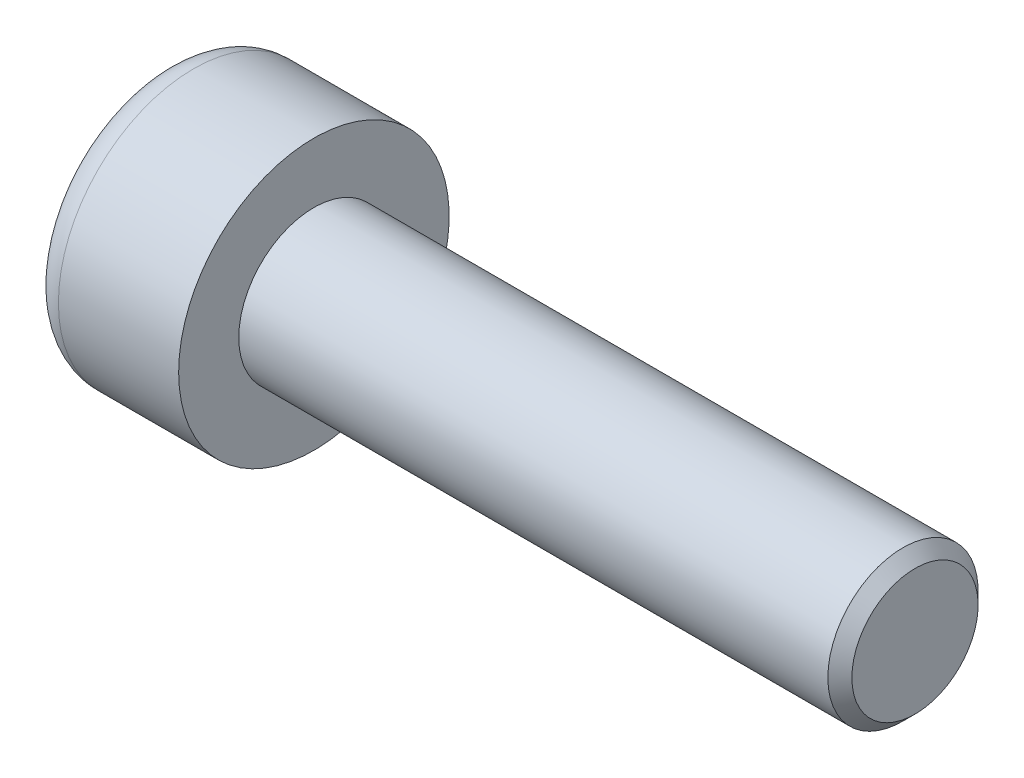
from build123d import *

# Parameters (mm, degrees)
CHANFREIN1_SIZE         = 0.2
CONG_1_R                = 0.5
EMPREINTE_POUR_CL_DEPTH = 2.5


with BuildPart() as part:
    # Esquisse1 → Base-Révolution (revolve)
    with BuildSketch(Plane.XY, mode=Mode.PRIVATE) as base_r_volution_sk:
        Polygon((-2.5, 0), (-2.5, 2.25), (0, 2.25), (0, 1.25), (10, 1.25), (10, 0), align=None)
    revolve(base_r_volution_sk.sketch.rotate(Axis((-28.982684825, 0, 0), (1, 0, 0)), 90), axis=Axis((-28.982684825, 0, 0), (1, 0, 0)))

    # Chanfrein1
    chanfrein1_edges = [part.edges().sort_by_distance(p)[0] for p in [
        (10, 0, -1.25),
    ]]
    chamfer(chanfrein1_edges, length=CHANFREIN1_SIZE)

    # Congé1
    cong_1_edges = [part.edges().sort_by_distance(p)[0] for p in [
        (-2.5, 0, -2.25),
    ]]
    fillet(cong_1_edges, radius=CONG_1_R)

    # Esquisse2 → Empreinte pour clé (cut)
    with BuildSketch(Plane.ZY.offset(2.5)):
        Polygon((0.577350269, -1), (-0.577350269, -1), (-1.154700538, 0), (-0.577350269, 1), (0.577350269, 1), (1.154700538, 0), align=None)
    extrude(amount=-EMPREINTE_POUR_CL_DEPTH, mode=Mode.SUBTRACT)


solid = part.part
